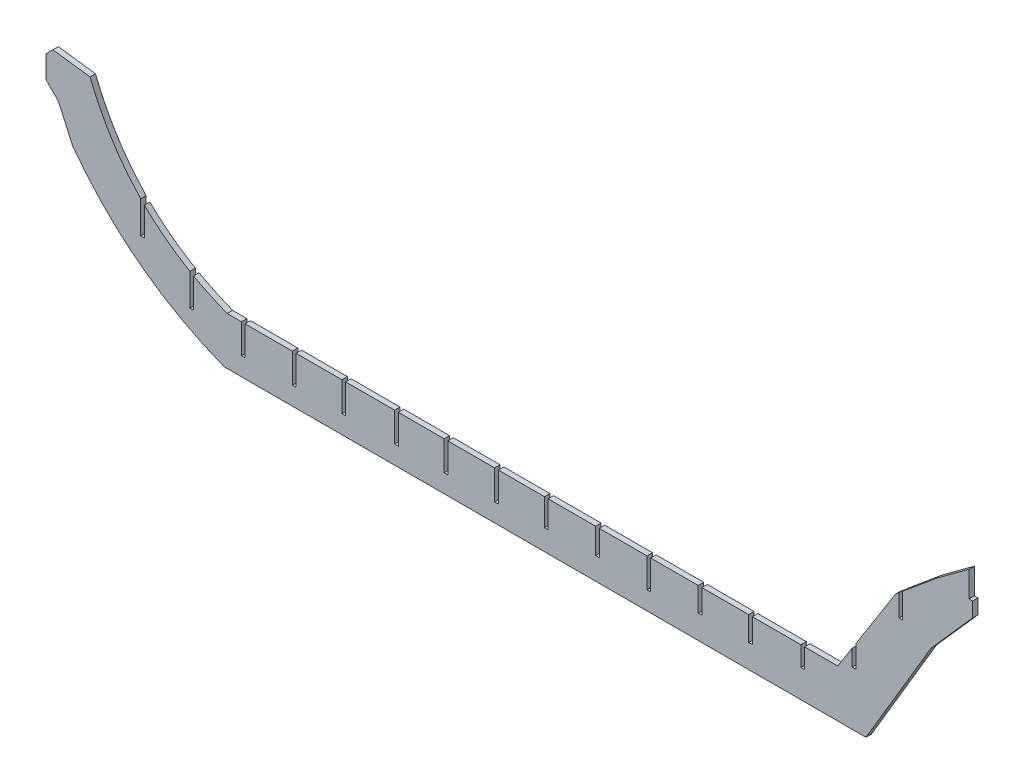
from build123d import *

# Parameters (mm, degrees)
BOSS_EXTRU_2_DEPTH      = 9
ENL_V_MAT_EXTRU_2_DEPTH = 9
ENL_V_MAT_EXTRU_3_DEPTH = 10


with BuildPart() as part:
    # Esquisse2 → Boss.-Extru.2 (new body)
    with BuildSketch(Plane.XY):
        with BuildLine():
            Line((0, 0), (-1055.446290734, 0))
            add(Edge.make_bspline(
                [(-1055.446290734, 0), (-1207.572733387, 59.072106031), (-1304.579199027, 189.593529265)],
                knots=[0, 0, 0, 1, 1, 1], degree=2))
            Line((-1304.579199027, 189.593529265), (-1328.155601237, 242.090877604))
            Line((-1328.155601237, 242.090877604), (-1348.517039509, 262.446992266))
            Line((-1348.517039509, 262.446992266), (-1348.517039509, 299.331021292))
            Line((-1348.517039509, 299.331021292), (-1337.24264668, 310.608362644))
            Line((-1337.24264668, 310.608362644), (-1275.966827179, 302.644588826))
            add(Edge.make_bspline(
                [(-1275.966827179, 302.644588826), (-1212.760641583, 141.531535954), (-1050.525159664, 78.394553502)],
                knots=[0, 0, 0, 1, 1, 1], degree=2))
            Line((-1050.525159664, 78.394553502), (-46.371074076, 78.394553502))
            Line((-46.371074076, 78.394553502), (48.76008987, 228.44376205))
            Line((48.76008987, 228.44376205), (115.880348206, 284.547364773))
            Line((115.880348206, 284.547364773), (175.286334456, 328.432610938))
            Line((175.286334456, 328.432610938), (175.286334456, 257.621549377))
            Line((175.286334456, 257.621549377), (107.11594567, 180.577636332))
            Line((107.11594567, 180.577636332), (0, 0))
        make_face()
    extrude(amount=BOSS_EXTRU_2_DEPTH)

    # Esquisse4 → Enlèv. mat.-Extru.2 (cut)
    with BuildSketch(Plane.XY.offset(9)):
        Polygon((-1192.710056644, 217.724215408), (-1192.710056644, 117.812636738), (-1186.710056644, 117.812636738), (-1186.710056644, 209.090265158), (-1144.70133954, 205.492785887), (-1111.824911273, 179.590935136), (-1111.824911273, 55.314515649), (-1105.824911273, 55.314515649), (-1105.824911273, 174.913937406), (-1058.771084869, 188.659470271), (-1027.191161845, 161.497477767), (-1027.191161845, 30), (-1021.191161845, 30), (-1021.191161845, 167.225098507), (-976.159938867, 174.429619005), (-943.229008237, 161.127659365), (-943.229008237, 30), (-937.229008237, 30), (-937.229008237, 164.093815562), (-899.191490776, 172.001101596), (-861.857811784, 160.098627493), (-861.857811784, 30), (-855.857811784, 30), (-855.857811784, 196.236545153), (-815.986169177, 204.901610664), (-775.188433973, 184.176190605), (-775.188433973, 30), (-769.188433973, 30), (-769.188433973, 176.450577912), (-732.223715867, 183.004336583), (-693.639593808, 163.215620457), (-693.639593808, 30), (-687.639593808, 30), (-687.639593808, 172.485228345), (-653.152535866, 182.871939208), (-610.716601792, 161.453305285), (-610.716601792, 30), (-604.716601792, 30), (-604.716601792, 256.125318922), (-551.321272632, 268.910222611), (-528.666744333, 255.862211449), (-528.666744333, 34.3), (-522.666744333, 34.3), (-522.666744333, 255.102102604), (-476.392141731, 269.107524931), (-444.607914754, 258.656296952), (-444.607914754, 36.7), (-438.607914754, 36.7), (-438.607914754, 253.443093933), (-391.056155042, 266.894918017), (-360.02126631, 254.206439852), (-360.02126631, 30), (-354.02126631, 30), (-354.02126631, 250.104032237), (-303.804875297, 262.547483763), (-275.81856885, 247.243298089), (-275.81856885, 39.1), (-269.81856885, 39.1), (-269.81856885, 230.071554094), (-217.437093626, 257.378680484), (-192.806508582, 246.762372601), (-192.806508582, 38.7), (-186.806508582, 38.7), (-186.806508582, 245.622867868), (-134.999273909, 264.79720393), (-106.993498927, 255.334085011), (-106.993498927, 46.1), (-100.993498927, 46.1), (-100.993498927, 258.655280604), (-22.735685337, 264.839286488), (-22.735685337, 88.7), (-16.735685337, 88.7), (-16.735685337, 231.395876397), (-1.733463181, 266.202092714), (54.176868866, 313.052154508), (54.176868866, 197.147050424), (60.176868866, 197.147050424), (60.176868866, 330.337520125), (-1075.947973634, 334.662873451), align=None)
    extrude(amount=-ENL_V_MAT_EXTRU_2_DEPTH, mode=Mode.SUBTRACT)

    # Esquisse5 → Enlèv. mat.-Extru.3 (cut)
    with BuildSketch(Plane.XY.offset(9)):
        Polygon((169.286334456, 324.000204482), (169.286334456, 281.800204482), (175.286334456, 281.800204482), (202.680394495, 285.052171219), (208.588297758, 339.079823363), (181.275473189, 338.718158681), align=None)
    extrude(amount=-ENL_V_MAT_EXTRU_3_DEPTH, mode=Mode.SUBTRACT)


solid = part.part
